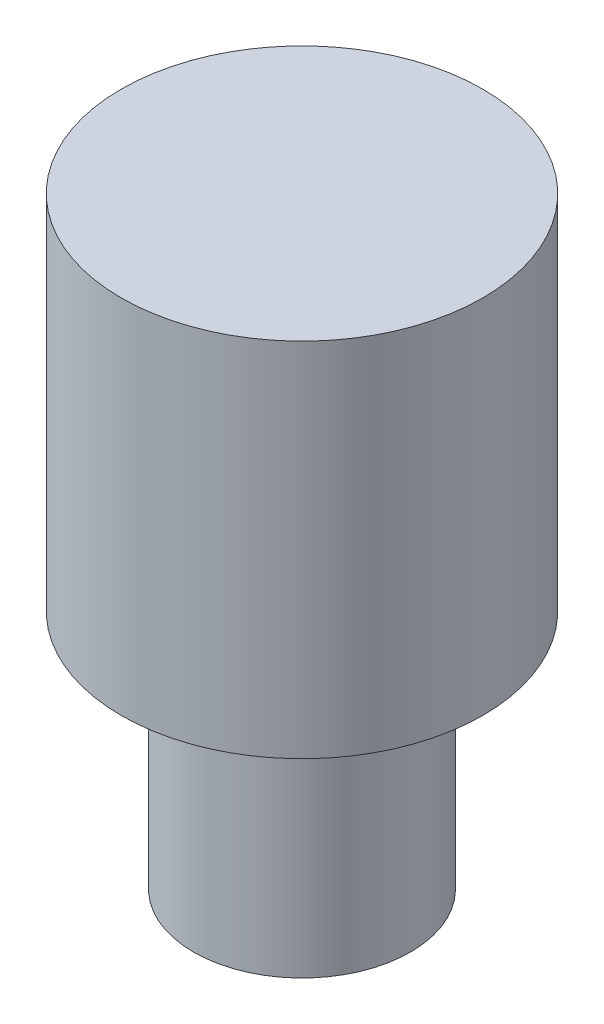
from build123d import *

# Parameters (mm, degrees)
SKETCH_1_R      = 9
EXTRUDE_1_DEPTH = 20
SKETCH_2_R      = 15
EXTRUDE_3_DEPTH = 30


with BuildPart() as part:
    # 草图1 → 凸台-拉伸1 (new body)
    with BuildSketch(Plane(origin=(0, 0, 0), x_dir=(1, 0, 0), z_dir=(0, 1, 0))):
        with Locations(Location((0, 0, 0), (0, 0, 270))):
            Circle(SKETCH_1_R)
    extrude(amount=EXTRUDE_1_DEPTH)


with BuildPart() as body_2:
    # 草图2 → 凸台-拉伸3 (new body)
    with BuildSketch(Plane(origin=(0, 20, 0), x_dir=(1, 0, 0), z_dir=(0, 1, 0))):
        with Locations(Location((0, 0, 0), (0, 0, 270))):
            Circle(SKETCH_2_R)
    extrude(amount=EXTRUDE_3_DEPTH)


solid = Compound([part.part, body_2.part])
